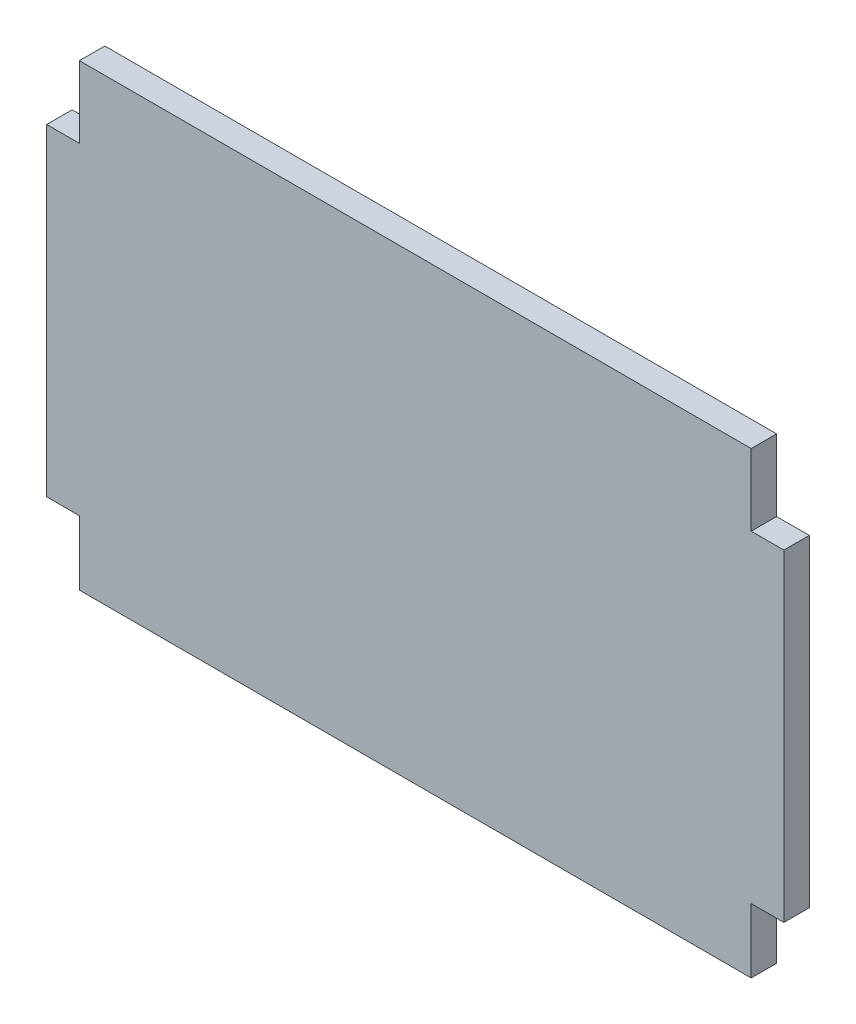
from build123d import *

# Parameters (mm, degrees)
SKETCH1_W           = 203.2
SKETCH1_H           = 126.4
BOSS_EXTRUDE1_DEPTH = 7
SKETCH2_W           = 9
SKETCH2_H           = 17.762306908
SKETCH2_H_2         = 19.737693092
CUT_EXTRUDE1_DEPTH  = 7


with BuildPart() as part:
    # Sketch1 → Boss-Extrude1 (new body)
    with BuildSketch(Plane.XY):
        with Locations((22.568789809, -14.038853503)):
            Rectangle(SKETCH1_W, SKETCH1_H)
    extrude(amount=BOSS_EXTRUDE1_DEPTH)

    # Sketch2 → Cut-Extrude1 (cut)
    with BuildSketch(Plane.XY.offset(7)):
        with Locations((-74.531210191, -68.357700049)):
            Rectangle(SKETCH2_W, SKETCH2_H)
        with Locations((119.668789809, -68.357700049)):
            Rectangle(SKETCH2_W, SKETCH2_H)
        with Locations((119.668789809, 39.292299951)):
            Rectangle(SKETCH2_W, SKETCH2_H_2)
        with Locations((-74.531210191, 39.292299951)):
            Rectangle(SKETCH2_W, SKETCH2_H_2)
    extrude(amount=-CUT_EXTRUDE1_DEPTH, mode=Mode.SUBTRACT)


solid = part.part
